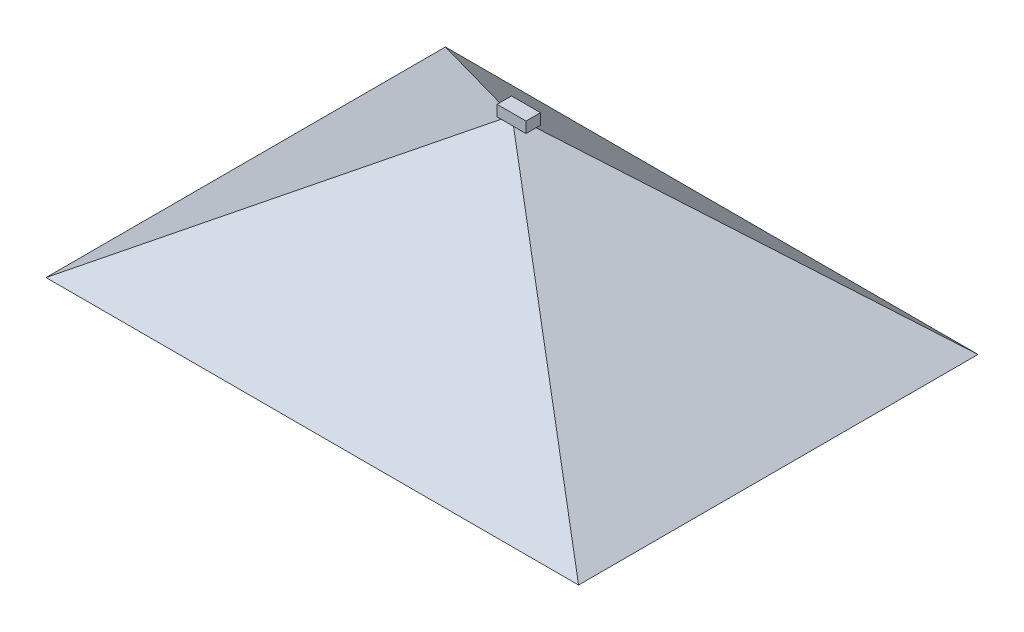
from build123d import *

# Parameters (mm, degrees)
SKETCH1_W           = 50.8
SKETCH1_H           = 25.4
BOSS_EXTRUDE1_DEPTH = 19.05
SKETCH2_R           = 7.635016023
CUT_EXTRUDE1_DEPTH  = 2.54


with BuildPart() as part:
    # Sketch1 → Boss-Extrude1 (new body)
    with BuildSketch(Plane(origin=(0, 0, 0), x_dir=(1, 0, 0), z_dir=(0, 1, 0))):
        Rectangle(SKETCH1_W, SKETCH1_H)
    extrude(amount=BOSS_EXTRUDE1_DEPTH)

    # Sketch2 → Cut-Extrude1 (cut)
    with BuildSketch(Plane.XZ):
        with Locations(Location((-11.830806994, 0, 0), (0, 0, 270))):
            Circle(SKETCH2_R)
    extrude(amount=-CUT_EXTRUDE1_DEPTH, mode=Mode.SUBTRACT)


with BuildPart() as body_2:
    # Sketch4 → Loft1 section 0
    with BuildSketch(Plane(origin=(0, -302.26, 0), x_dir=(-1, 0, 0), z_dir=(0, -1, 0)), mode=Mode.PRIVATE) as loft1_s0:
        with BuildLine():
            Line((-455.529193006, 350.52), (479.190806994, 350.52))
            Line((479.190806994, 350.52), (479.190806994, -350.52))
            Line((479.190806994, -350.52), (-455.529193006, -350.52))
            Line((-455.529193006, -350.52), (-455.529193006, 350.52))
        make_face()
    loft([loft1_s0.sketch, Vertex(-11.830806994, 2.54, 0)])


solid = Compound([part.part, body_2.part])
